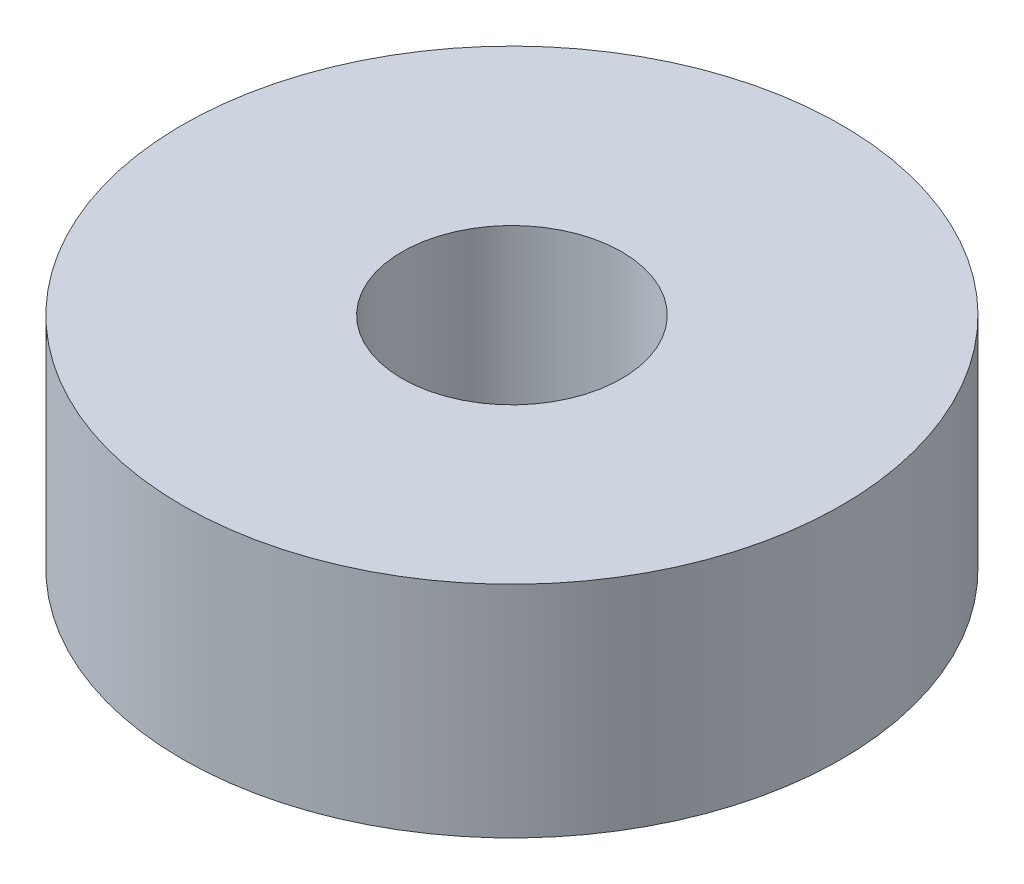
from build123d import *

# Parameters (mm, degrees)
CROQUIS1_R              = 15
CROQUIS1_R_2            = 5
SALIENTE_EXTRUIR1_DEPTH = 10


with BuildPart() as part:
    # Croquis1 → Saliente-Extruir1 (new body)
    with BuildSketch(Plane(origin=(0, 0, 0), x_dir=(1, 0, 0), z_dir=(0, 1, 0))):
        with Locations(Location((0, 0, 0), (0, 0, 270))):
            Circle(CROQUIS1_R)
        with Locations(Location((0, 0, 0), (0, 0, 270))):
            Circle(CROQUIS1_R_2, mode=Mode.SUBTRACT)
    extrude(amount=SALIENTE_EXTRUIR1_DEPTH)


solid = part.part
